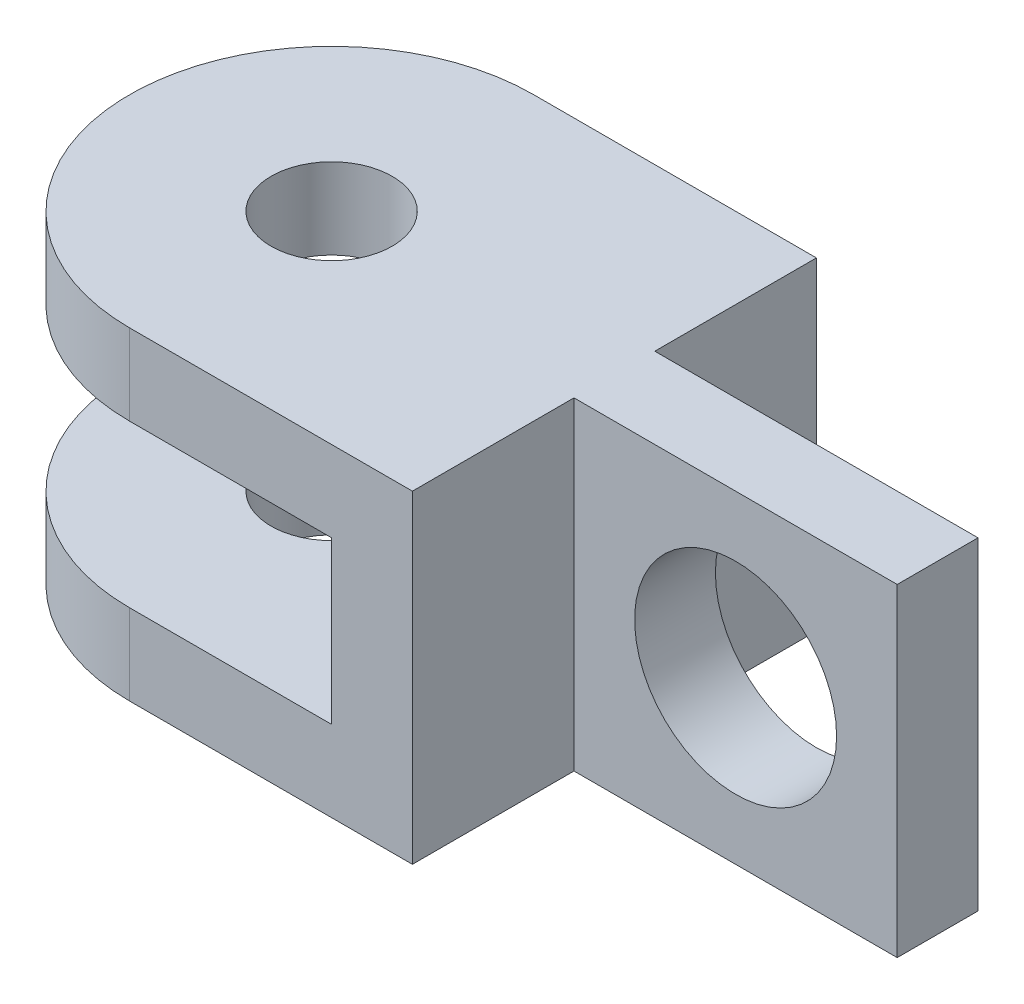
from build123d import *

# Parameters (mm, degrees)
SKETCH_1_R          = 15
EXTRUDE_1_DEPTH     = 80
SKETCH_5_R          = 25
SKETCH_5_W          = 200
SKETCH_5_H          = 40
CUT_EXTRUDE_5_DEPTH = 100
SKETCH_6_W          = 100
SKETCH_6_H          = 100
CUT_EXTRUDE_7_DEPTH = 40
SKETCH_8_W          = 100
SKETCH_8_H          = 100
CUT_EXTRUDE_8_DEPTH = 40


with BuildPart() as part:
    # 草图1 → 凸台-拉伸1 (new body)
    with BuildSketch(Plane(origin=(0, 0, 0), x_dir=(1, 0, 0), z_dir=(0, 1, 0))):
        with BuildLine():
            Line((50, 0), (200, 0))
            Line((200, 0), (200, -100))
            Line((200, -100), (50, -100))
            ThreePointArc((50, -100), (0, -50), (50, 0))
        make_face()
        with Locations(Location((50, -50, 0), (0, 0, 270))):
            Circle(SKETCH_1_R, mode=Mode.SUBTRACT)
    extrude(amount=EXTRUDE_1_DEPTH)

    # 草图5 → 切除-拉伸5 (cut)
    with BuildSketch(Plane.XY.offset(100)):
        with Locations((160, 40)):
            Circle(SKETCH_5_R)
        with Locations((0, 40)):
            Rectangle(SKETCH_5_W, SKETCH_5_H)
    extrude(amount=-CUT_EXTRUDE_5_DEPTH, mode=Mode.SUBTRACT)

    # 草图6 → 切除-拉伸7 (cut)
    with BuildSketch(Plane.XY.offset(100)):
        with Locations((170, 40)):
            Rectangle(SKETCH_6_W, SKETCH_6_H)
    extrude(amount=-CUT_EXTRUDE_7_DEPTH, mode=Mode.SUBTRACT)

    # 草图8 → 切除-拉伸8 (cut)
    with BuildSketch(Plane(origin=(0, 0, 0), x_dir=(-1, 0, 0), z_dir=(0, 0, -1))):
        with Locations((-170, 40)):
            Rectangle(SKETCH_8_W, SKETCH_8_H)
    extrude(amount=-CUT_EXTRUDE_8_DEPTH, mode=Mode.SUBTRACT)


solid = part.part
